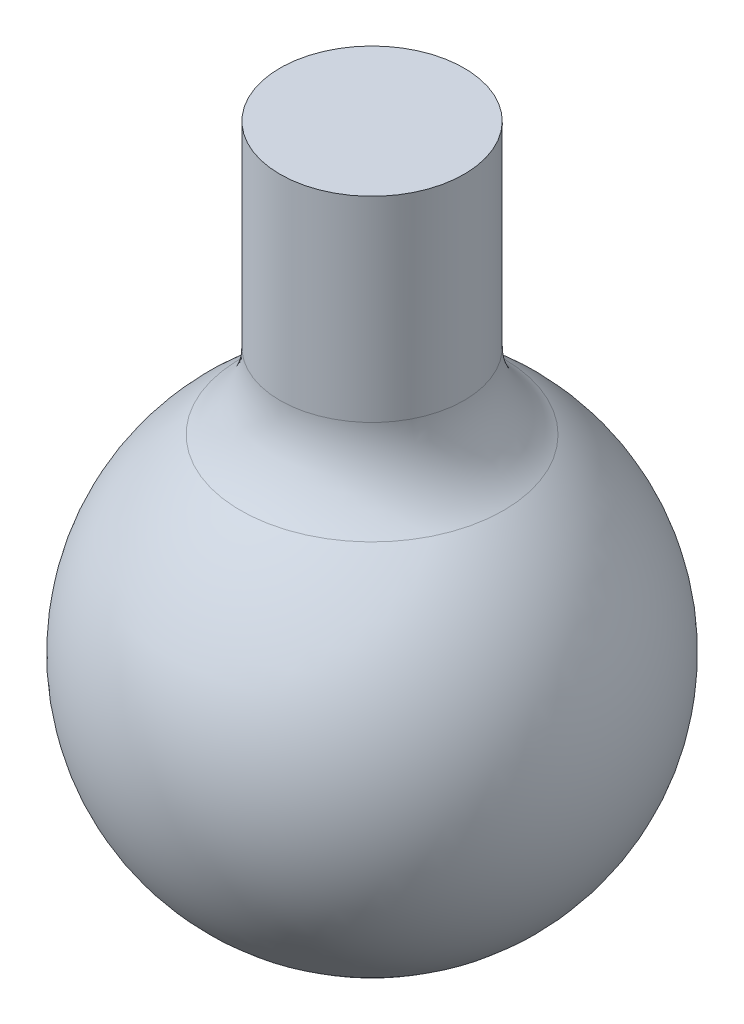
from build123d import *

# Parameters (mm, degrees)
BOSS_EXTRUDE2_REACH      = 18.583
BOSS_EXTRUDE2_END_RADIUS = 5
SKETCH2_R                = 2
FILLET1_R                = 2


with BuildPart() as part:
    # Sketch1 → Revolve1 (revolve)
    with BuildSketch(Plane.XY):
        with BuildLine():
            Line((0, 5), (0, -5))
            ThreePointArc((0, -5), (-5, 0), (0, 5))
        make_face()
    revolve(axis=Axis((0, 5, 0), (0, -1, 0)))

    # Boss-Extrude2: up to this sphere (the profile starts outside it)
    boss_extrude2_end = Location((0, 0, 0)) * Sphere(BOSS_EXTRUDE2_END_RADIUS, mode=Mode.PRIVATE)
    # Sketch2 → Boss-Extrude2 (add, up to the surface)
    with BuildSketch(Plane(origin=(0, 10, 0), x_dir=(1, 0, 0), z_dir=(0, 1, 0)), mode=Mode.PRIVATE) as boss_extrude2_sk1:
        with Locations(Location((0, 0, 0), (0, 0, 270))):
            Circle(SKETCH2_R)
    boss_extrude2_tool1 = extrude(boss_extrude2_sk1.sketch, amount=-BOSS_EXTRUDE2_REACH, mode=Mode.PRIVATE) - boss_extrude2_end
    add(boss_extrude2_tool1.solids().sort_by_distance((0, 10, 0))[0])

    # Fillet1
    fillet1_edges = [part.edges().sort_by_distance(p)[0] for p in [
        (1.414213562, 4.582575695, -1.414213562),
    ]]
    fillet(fillet1_edges, radius=FILLET1_R)


solid = part.part
